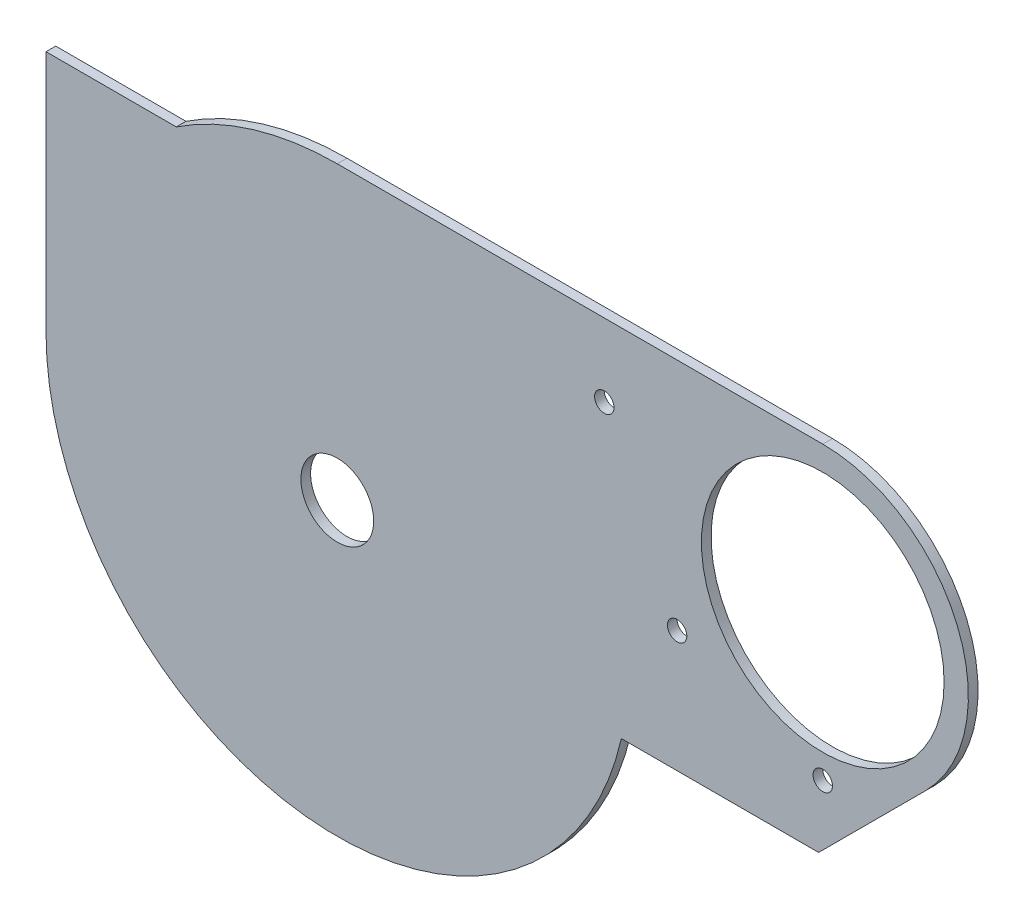
from build123d import *

# Parameters (mm, degrees)
SKETCH1_R           = 7.5
SKETCH1_R_2         = 25
BOSS_EXTRUDE1_DEPTH = 2
CUT_EXTRUDE1_REACH  = 145.192
SKETCH2_R           = 2
SKETCH3_R           = 2
CUT_EXTRUDE2_DEPTH  = 10


with BuildPart() as part:
    # Sketch1 → Boss-Extrude1 (new body)
    # profile 1 of 2: a face of its own
    with BuildSketch(Plane.XY):
        with BuildLine():
            ThreePointArc((-60, 0), (-52.867640737, 28.372743309), (-33.166247904, 50))
            Line((-33.166247904, 50), (-60, 50))
            Line((-60, 50), (-60, 0))
        make_face()
    # profile 2 of 2: a face of its own
    with BuildSketch(Plane.XY):
        with BuildLine():
            ThreePointArc((0, 60), (-17.320508076, 57.445626465), (-33.166247904, 50))
            ThreePointArc((-33.166247904, 50), (-52.867640737, 28.372743309), (-60, 0))
            ThreePointArc((-60, 0), (-6.678621673, -59.627141576), (58.513200418, -13.274237334))
            Line((58.513200418, -13.274237334), (99.152169538, -13.274237334))
            Line((99.152169538, -13.274237334), (121.213203436, 8.786796564))
            ThreePointArc((121.213203436, 8.786796564), (127.716385975, 41.480502971), (100, 60))
            Line((100, 60), (0, 60))
        make_face()
        Circle(SKETCH1_R, mode=Mode.SUBTRACT)
        with Locations((100, 30)):
            Circle(SKETCH1_R_2, mode=Mode.SUBTRACT)
    extrude(amount=BOSS_EXTRUDE1_DEPTH)

    # Sketch2 → Cut-Extrude1 (cut, up to next)
    with BuildSketch(Plane.XY.offset(2), mode=Mode.PRIVATE) as cut_extrude1_sk1:
        with Locations((55, 45)):
            Circle(SKETCH2_R)
    cut_extrude1_tool1 = extrude(cut_extrude1_sk1.sketch, amount=-CUT_EXTRUDE1_REACH, mode=Mode.PRIVATE) & part.part
    # Sketch2 → Cut-Extrude1 (cut, up to next)
    with BuildSketch(Plane.XY.offset(2), mode=Mode.PRIVATE) as cut_extrude1_sk2:
        with Locations((70, 11.725762666)):
            Circle(SKETCH2_R)
    cut_extrude1_tool2 = extrude(cut_extrude1_sk2.sketch, amount=-CUT_EXTRUDE1_REACH, mode=Mode.PRIVATE) & part.part
    add(cut_extrude1_tool1.solids().sort_by_distance((55, 45, 2))[0], mode=Mode.SUBTRACT)
    add(cut_extrude1_tool2.solids().sort_by_distance((70, 11.725763, 2))[0], mode=Mode.SUBTRACT)

    # Sketch3 → Cut-Extrude2 (cut)
    with BuildSketch(Plane.XY.offset(2)):
        with Locations((100, 0)):
            Circle(SKETCH3_R)
    extrude(amount=-CUT_EXTRUDE2_DEPTH, mode=Mode.SUBTRACT)


solid = part.part
